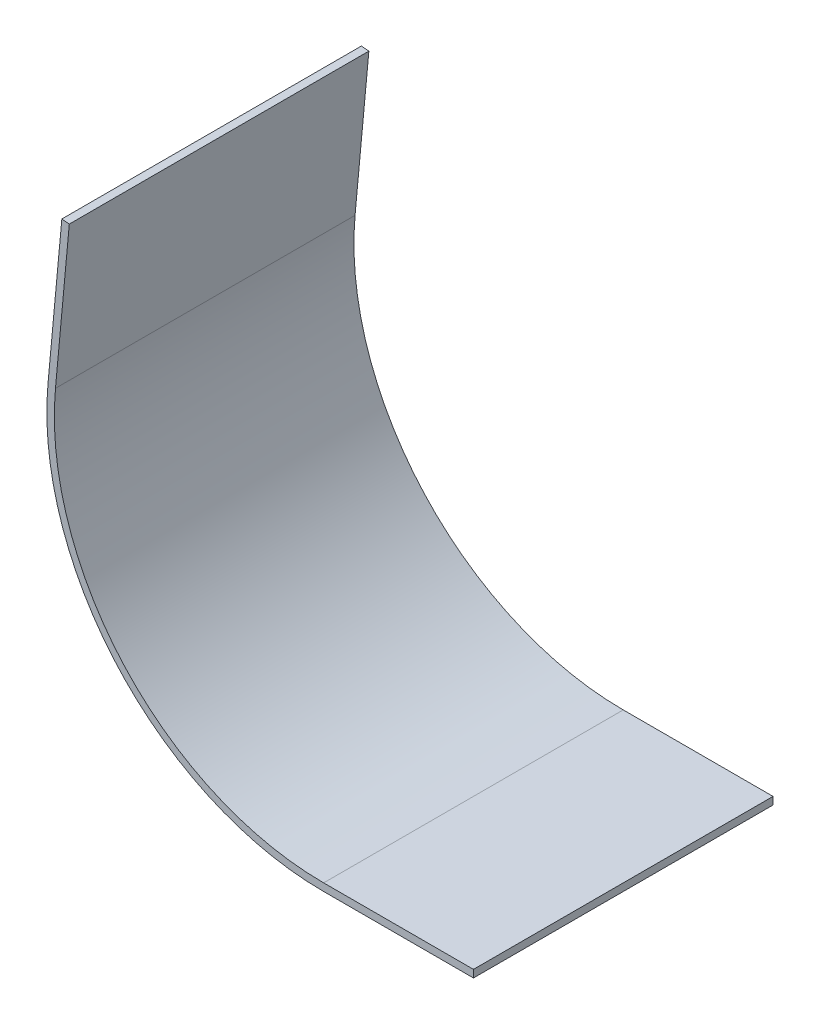
from build123d import *

# Parameters (mm, degrees)
BOSS_EXTRUDE1_DEPTH = 20


with BuildPart() as part:
    # Sketch1 → Boss-Extrude1 (new body)
    with BuildSketch(Plane.XY):
        with BuildLine():
            Line((10, -0.25), (10, 0.25))
            Line((10, 0.25), (0, 0.25))
            ThreePointArc((0, 0.25), (-13.289004078, 6.117752441), (-17.905282596, 19.891572562))
            Line((-17.905282596, 19.891572562), (-16.982390424, 29.848894995))
            Line((-16.982390424, 29.848894995), (-17.480256546, 29.895039604))
            Line((-17.480256546, 29.895039604), (-18.403148718, 19.937717171))
            ThreePointArc((-18.403148718, 19.937717171), (-13.658512065, 5.780908489), (0, -0.25))
            Line((0, -0.25), (10, -0.25))
        make_face()
    extrude(amount=-BOSS_EXTRUDE1_DEPTH)


solid = part.part
